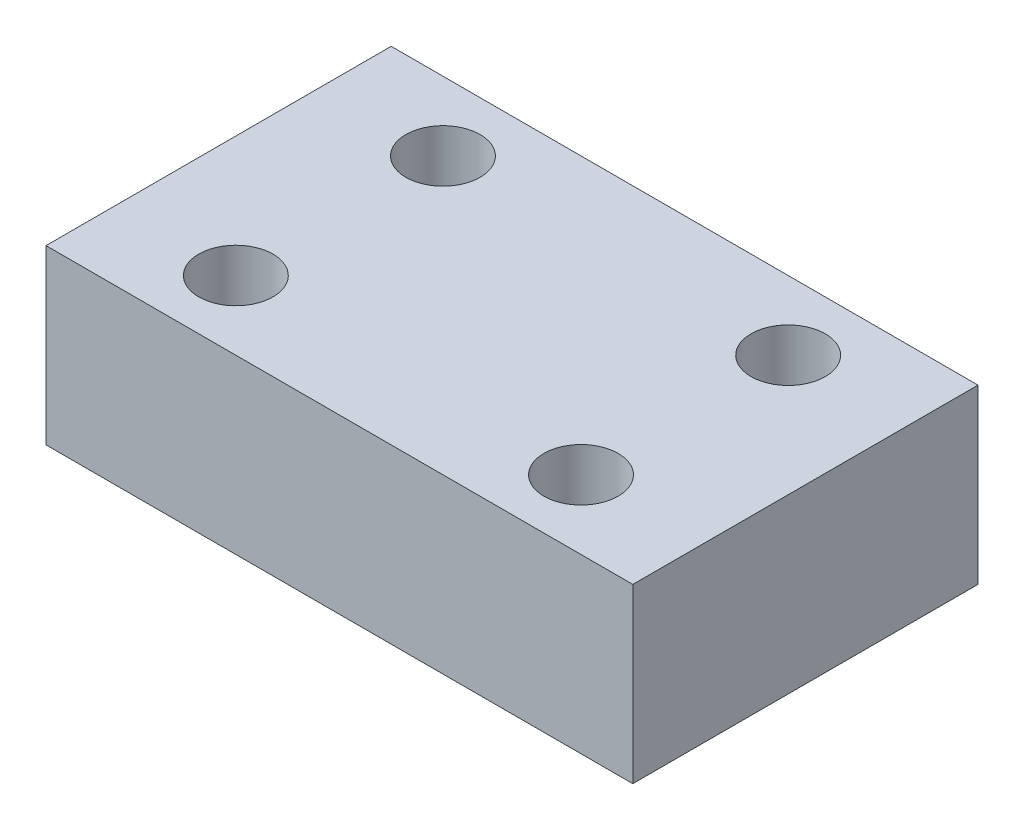
from build123d import *

# Parameters (mm, degrees)
SKETCH12_W           = 34
SKETCH12_H           = 20
BOSS_EXTRUDE2_DEPTH  = 10
M4_CLEARANCE_HOLE1_D = 4.3


with BuildPart() as part:
    # Sketch12 → Boss-Extrude2 (new body)
    with BuildSketch(Plane(origin=(0, 0, 0), x_dir=(1, 0, 0), z_dir=(0, 1, 0))):
        Rectangle(SKETCH12_W, SKETCH12_H)
    extrude(amount=-BOSS_EXTRUDE2_DEPTH)

    # M4 Clearance Hole1 (through all)
    with Locations(Plane(origin=(-10, 0, -6), x_dir=(0, 0, 1), z_dir=(0, 1, 0))):
        with Locations((0, 0), (12, 0), (12, 20), (0, 20)):
            Hole(M4_CLEARANCE_HOLE1_D / 2)


solid = part.part
